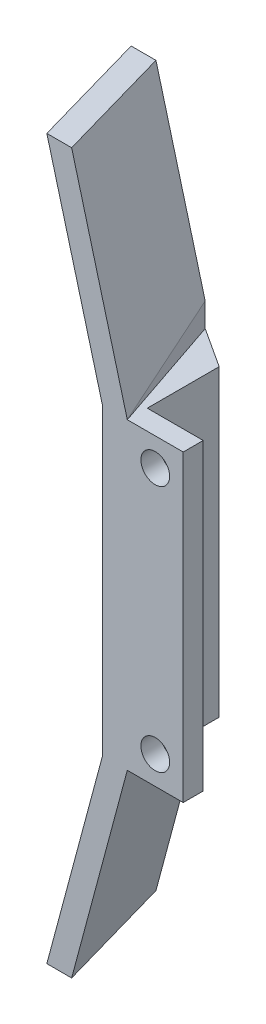
from build123d import *

# Parameters (mm, degrees)
ESQUISSE10_W            = 10.105828541
ESQUISSE10_H            = 38
BOSS_EXTRU_1_DEPTH      = 2.5
ESQUISSE13_R            = 1.8
ENL_V_MAT_EXTRU_1_DEPTH = 2.5
BOSS_EXTRU_2_REACH      = 51.459
ESQUISSE16_W            = 9
ESQUISSE16_H            = 38
NERVURE3_REACH          = 51.459
ESQUISSE17_WALL_W       = 106.880712272
ESQUISSE17_WALL_H       = 38


with BuildPart() as part:
    # Esquisse12 → Lissage4 section 0
    with BuildSketch(Plane(origin=(0, 0, 0), x_dir=(-1, 0, 0), z_dir=(0, 0, -1))):
        with BuildLine():
            Line((0, -19), (0, 19))
            Line((0, 19), (6.966679003, 45))
            Line((6.966679003, 45), (10.072507544, 45))
            Line((10.072507544, 45), (3.105828541, 19))
            Line((3.105828541, 19), (3.105828541, -19))
            Line((3.105828541, -19), (10.072507544, -45))
            Line((10.072507544, -45), (6.966679003, -45))
            Line((6.966679003, -45), (0, -19))
        make_face()
    # Esquisse11 → Lissage4 section 1
    with BuildSketch(Plane.XY.offset(-14.75)):
        with BuildLine():
            Line((-11.162831426, 45), (-14.268659967, 45))
            Line((-14.268659967, 45), (-8.105828541, 22))
            Line((-8.105828541, 22), (-8.105828541, -22))
            Line((-8.105828541, -22), (-14.268659967, -45))
            Line((-14.268659967, -45), (-11.162831426, -45))
            Line((-11.162831426, -45), (-5, -22))
            Line((-5, -22), (-5, 22))
            Line((-5, 22), (-11.162831426, 45))
        make_face()
    loft()



with BuildPart() as body_2:
    # Esquisse10 → Boss.-Extru.1 (new body)
    with BuildSketch(Plane.XY):
        with Locations((1.947085729, 0)):
            Rectangle(ESQUISSE10_W, ESQUISSE10_H)
    extrude(amount=-BOSS_EXTRU_1_DEPTH)

    # Esquisse13 → Enlèv. mat.-Extru.1 (cut)
    with BuildSketch(Plane.XY):
        with Locations((3.5, 15.5)):
            Circle(ESQUISSE13_R)
        with Locations((3.5, -15.5)):
            Circle(ESQUISSE13_R)
    extrude(amount=-ENL_V_MAT_EXTRU_1_DEPTH, mode=Mode.SUBTRACT)


with BuildPart() as part_1:
    add(part.part)

    add(body_2.part)  # Boss.-Extru.2 merges body 2
    # Boss.-Extru.2: up to this plane
    boss_extru_2_end = Plane(origin=(0, 0, 0), z_dir=(0.9470658794157988, 0, -0.32103928115789765))
    # Esquisse16 → Boss.-Extru.2 (add, up to the surface)
    with BuildSketch(Plane(origin=(0, 0, 0), x_dir=(0, 0, -1), z_dir=(1, 0, 0)), mode=Mode.PRIVATE) as boss_extru_2_sk1:
        with Locations((7, 0)):
            Rectangle(ESQUISSE16_W, ESQUISSE16_H)
    boss_extru_2_tool1 = split(extrude(boss_extru_2_sk1.sketch, amount=-BOSS_EXTRU_2_REACH, mode=Mode.PRIVATE), bisect_by=boss_extru_2_end, keep=Keep.BOTH, mode=Mode.PRIVATE)
    add(boss_extru_2_tool1.solids().sort_by_distance((0, 0, -7))[0])

    # Esquisse17 wall → Nervure3 (add, up to next)
    with BuildSketch(Plane(origin=(-2.5, 0, -13.125), x_dir=(-0.838443616301, 0, -0.544988350595), z_dir=(-0.544988350595, 0, 0.838443616301)), mode=Mode.PRIVATE) as nervure3_sk1:
        Rectangle(ESQUISSE17_WALL_W, ESQUISSE17_WALL_H)
    nervure3_tool1 = extrude(nervure3_sk1.sketch, amount=NERVURE3_REACH, mode=Mode.PRIVATE) - part_1.part
    add(nervure3_tool1.solids().sort_by_distance((-2.5, 0, -13.125))[0])


solid = part_1.part
